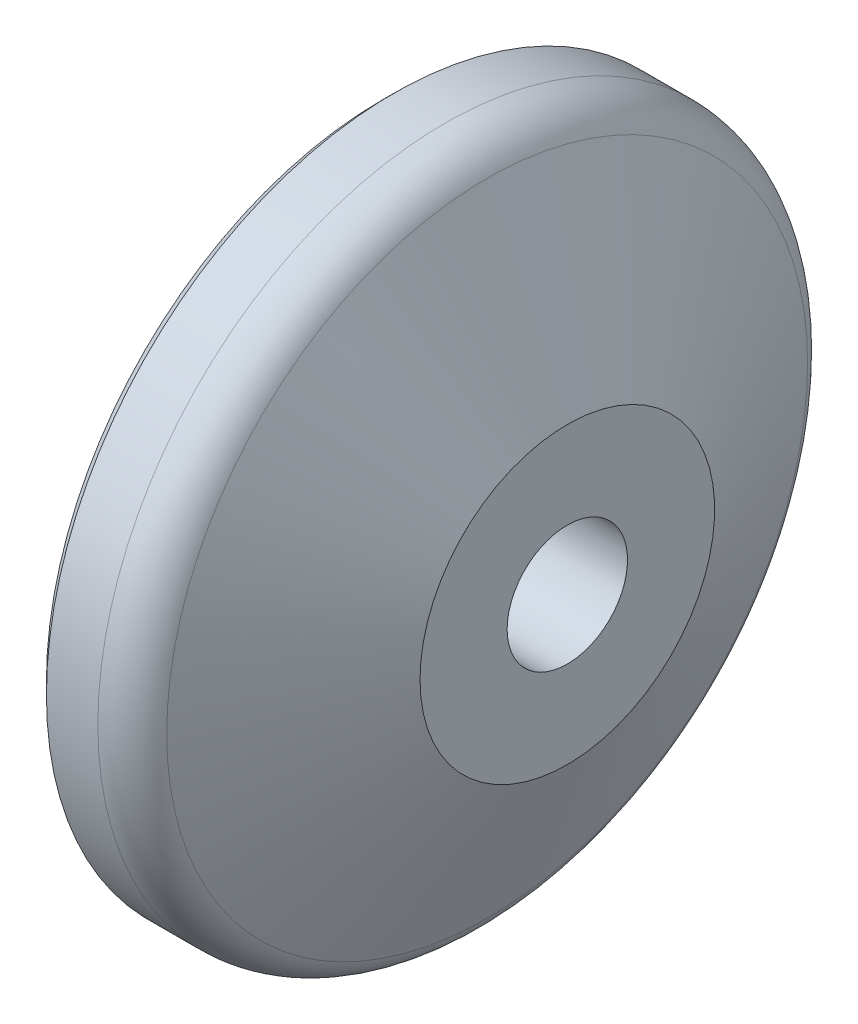
from build123d import *

# Parameters (mm, degrees)
FILLET1_R     = 2
CHAMFER1_SIZE = 0.5


with BuildPart() as part:
    # Sketch1 → Revolve1 (revolve)
    with BuildSketch(Plane.XY, mode=Mode.PRIVATE) as revolve1_sk:
        Polygon((0, 4), (0, 15), (4, 15), (8, 6.362924355), (8, 2.6), (4, 2.6), (4, 4), align=None)
    revolve(revolve1_sk.sketch.rotate(Axis((0, 0, 0), (1, 0, 0)), 90), axis=Axis((0, 0, 0), (1, 0, 0)))

    # Fillet1
    fillet1_edges = [part.edges().sort_by_distance(p)[0] for p in [
        (4, 0, -15),
    ]]
    fillet(fillet1_edges, radius=FILLET1_R)

    # Chamfer1
    chamfer1_edges = [part.edges().sort_by_distance(p)[0] for p in [
        (0, 0, -15),
        (0, 0, -4),
    ]]
    chamfer(chamfer1_edges, length=CHAMFER1_SIZE)


solid = part.part
